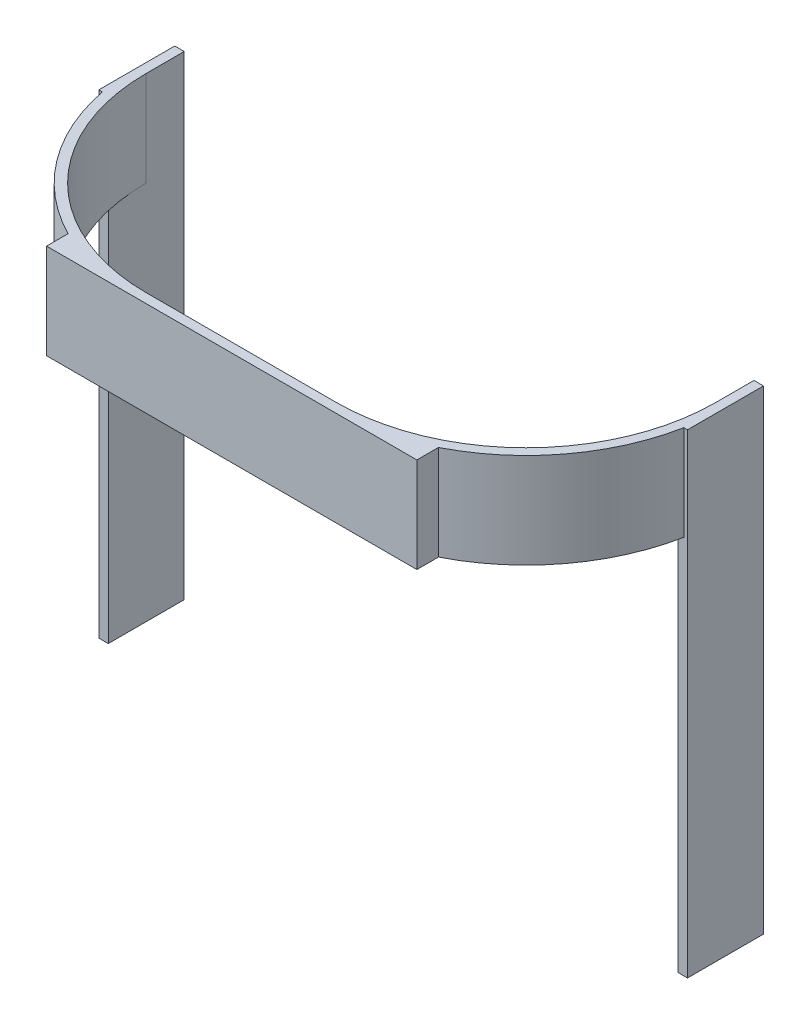
from build123d import *

# Parameters (mm, degrees)
EXTRUDE_1_DEPTH = 40
SKETCH_3_W      = 4
SKETCH_3_H      = 32
EXTRUDE_2_DEPTH = 160
EXTRUDE_3_DEPTH = 40


with BuildPart() as part:
    # 草图2 → 凸台-拉伸1 (new body)
    with BuildSketch(Plane(origin=(0, 0, 0), x_dir=(1, 0, 0), z_dir=(0, 1, 0))):
        with BuildLine():
            Line((-40, -80), (40, -80))
            ThreePointArc((40, -80), (96.568542495, -56.568542495), (120, 0))
            Line((120, 0), (120, 16))
            Line((120, 16), (124, 16))
            Line((124, 16), (124, -16))
            Line((124, -16), (122.462112512, -16))
            ThreePointArc((122.462112512, -16), (93.441556864, -64.807406984), (40, -84))
            Line((40, -84), (-40, -84))
            ThreePointArc((-40, -84), (-93.441556864, -64.807406984), (-122.462112512, -16))
            Line((-122.462112512, -16), (-124, -16))
            Line((-124, -16), (-124, 16))
            Line((-124, 16), (-120, 16))
            Line((-120, 16), (-120, 0))
            ThreePointArc((-120, 0), (-96.568542495, -56.568542495), (-40, -80))
        make_face()
    extrude(amount=EXTRUDE_1_DEPTH)

    # 草图3 → 凸台-拉伸2 (add)
    with BuildSketch(Plane.XZ):
        with Locations((-122, 0)):
            Rectangle(SKETCH_3_W, SKETCH_3_H)
        with Locations((122, 0)):
            Rectangle(SKETCH_3_W, SKETCH_3_H)
    extrude(amount=EXTRUDE_2_DEPTH)

    # 草图5 → 凸台-拉伸3 (add)
    with BuildSketch(Plane(origin=(0, 40, 0), x_dir=(1, 0, 0), z_dir=(0, 1, 0))):
        Polygon((-40, -84), (-78, -84), (-78, -74.913283201), (-55.5334574, -80.946187921), (52.897278528, -80.946187921), (78, -72.607731722), (78, -84), (40, -84), align=None)
    extrude(amount=-EXTRUDE_3_DEPTH)


solid = part.part
